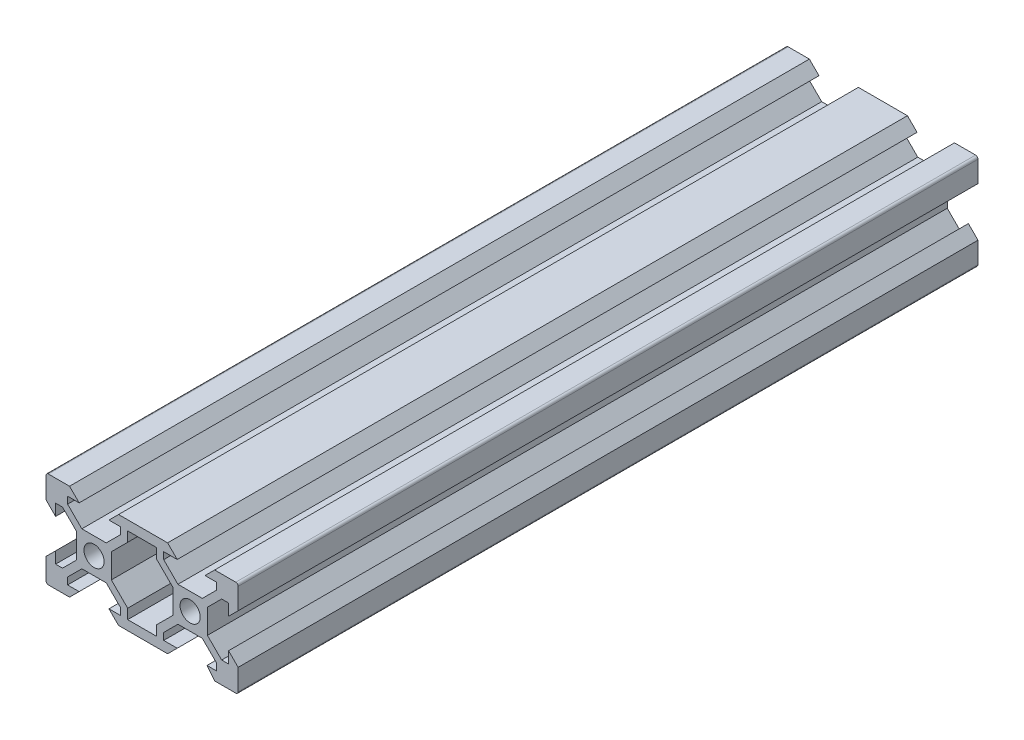
from build123d import *

# Parameters (mm, degrees)
SKETCH1_R           = 2.1
BOSS_EXTRUDE1_DEPTH = 154
FILLET1_R           = 0.5


with BuildPart() as part:
    # Sketch1 → Boss-Extrude1 (new body)
    with BuildSketch(Plane.XY):
        Polygon((-20, -10), (-15.5, -10), (-15.1, -10), (-13.1, -8), (-15.5, -8), (-15.5, -6.560660172), (-12.539339828, -3.6), (-7.460660172, -3.6), (-4.5, -6.560660172), (-4.5, -8), (-6.9, -8), (-4.9, -10), (5.313777138, -10), (7.313777138, -8), (4.5, -8), (4.5, -6.560660172), (7.460660172, -3.6), (12.539339828, -3.6), (15.5, -6.560660172), (15.5, -8), (13.513777138, -8), (15.1, -10), (15.5, -10), (20, -10), (20, -5.5), (20, -5.1), (18, -3.1), (18, -5.5), (16.560660172, -5.5), (13.6, -2.539339828), (13.6, 2.539339828), (16.560660172, 5.5), (18, 5.5), (18, 3.1), (20, 5.1), (20, 5.5), (20, 10), (15.5, 10), (15.1, 10), (13.1, 8), (15.5, 8), (15.5, 6.560660172), (12.539339828, 3.6), (7.460660172, 3.6), (4.5, 6.560660172), (4.5, 8), (7.313777138, 8), (5.313777138, 10), (-4.9, 10), (-6.9, 8), (-4.5, 8), (-4.5, 6.560660172), (-7.460660172, 3.6), (-12.539339828, 3.6), (-15.5, 6.560660172), (-15.5, 8), (-13.1, 8), (-15.1, 10), (-15.5, 10), (-20, 10), (-20, 5.5), (-20, 5.1), (-18, 3.1), (-18, 5.5), (-16.560660172, 5.5), (-13.6, 2.539339828), (-13.6, -2.539339828), (-16.560660172, -5.5), (-18, -5.5), (-18, -3.1), (-20, -5.1), (-20, -5.5), align=None)
        with Locations((-10, 0)):
            Circle(SKETCH1_R, mode=Mode.SUBTRACT)
        with Locations((10, 0)):
            Circle(SKETCH1_R, mode=Mode.SUBTRACT)
        Polygon((3, -5.939339828), (3, -8), (-3, -8), (-3, -5.939339828), (-6.4, -2.539339828), (-6.4, 2.539339828), (-3, 5.939339828), (-3, 8), (3, 8), (3, 5.939339828), (6.4, 2.539339828), (6.4, -2.539339828), align=None, mode=Mode.SUBTRACT)
    extrude(amount=BOSS_EXTRUDE1_DEPTH)

    # Fillet1
    fillet1_edges = [part.edges().sort_by_distance(p)[0] for p in [
        (-20, 10, 77),
        (20, 10, 77),
        (20, -10, 77),
        (-20, -10, 77),
    ]]
    fillet(fillet1_edges, radius=FILLET1_R)


solid = part.part
